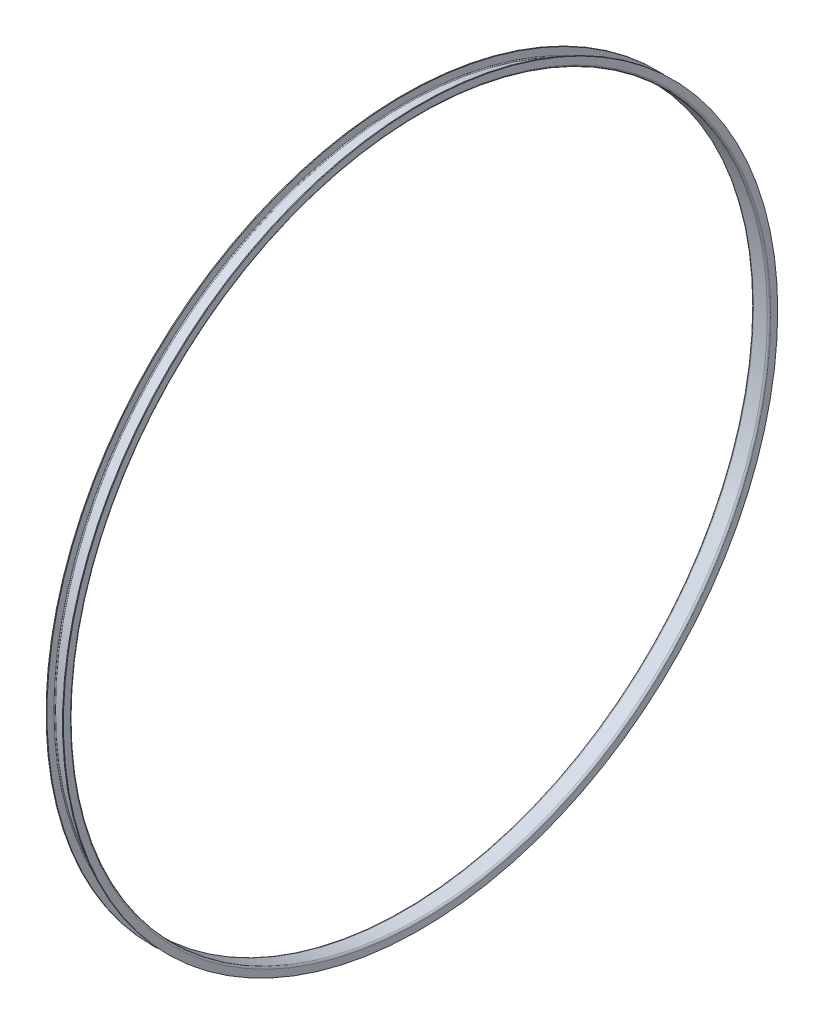
from build123d import *


with BuildPart() as part:
    # Sketch1 → Revolve1 (revolve)
    with BuildSketch(Plane.XY, mode=Mode.PRIVATE) as revolve1_sk:
        with BuildLine():
            Line((-38, 75.537190083), (-38, 59.537190083))
            ThreePointArc((-38, 59.537190083), (-36.828427125, 56.708762958), (-34, 55.537190083))
            Line((-34, 55.537190083), (-2, 55.537190083))
            ThreePointArc((-2, 55.537190083), (0.828427125, 56.708762958), (2, 59.537190083))
            Line((2, 59.537190083), (2, 75.537190083))
            Line((2, 75.537190083), (0, 75.537190083))
            Line((0, 75.537190083), (0, 59.537190083))
            ThreePointArc((0, 59.537190083), (-0.585786438, 58.12297652), (-2, 57.537190083))
            Line((-2, 57.537190083), (-34, 57.537190083))
            ThreePointArc((-34, 57.537190083), (-35.414213562, 58.12297652), (-36, 59.537190083))
            Line((-36, 59.537190083), (-36, 75.537190083))
            Line((-36, 75.537190083), (-38, 75.537190083))
        make_face()
    revolve(revolve1_sk.sketch.rotate(Axis((63.944474241, -749.462809917, 0), (-1, 0, 0)), 90), axis=Axis((63.944474241, -749.462809917, 0), (-1, 0, 0)))


solid = part.part
